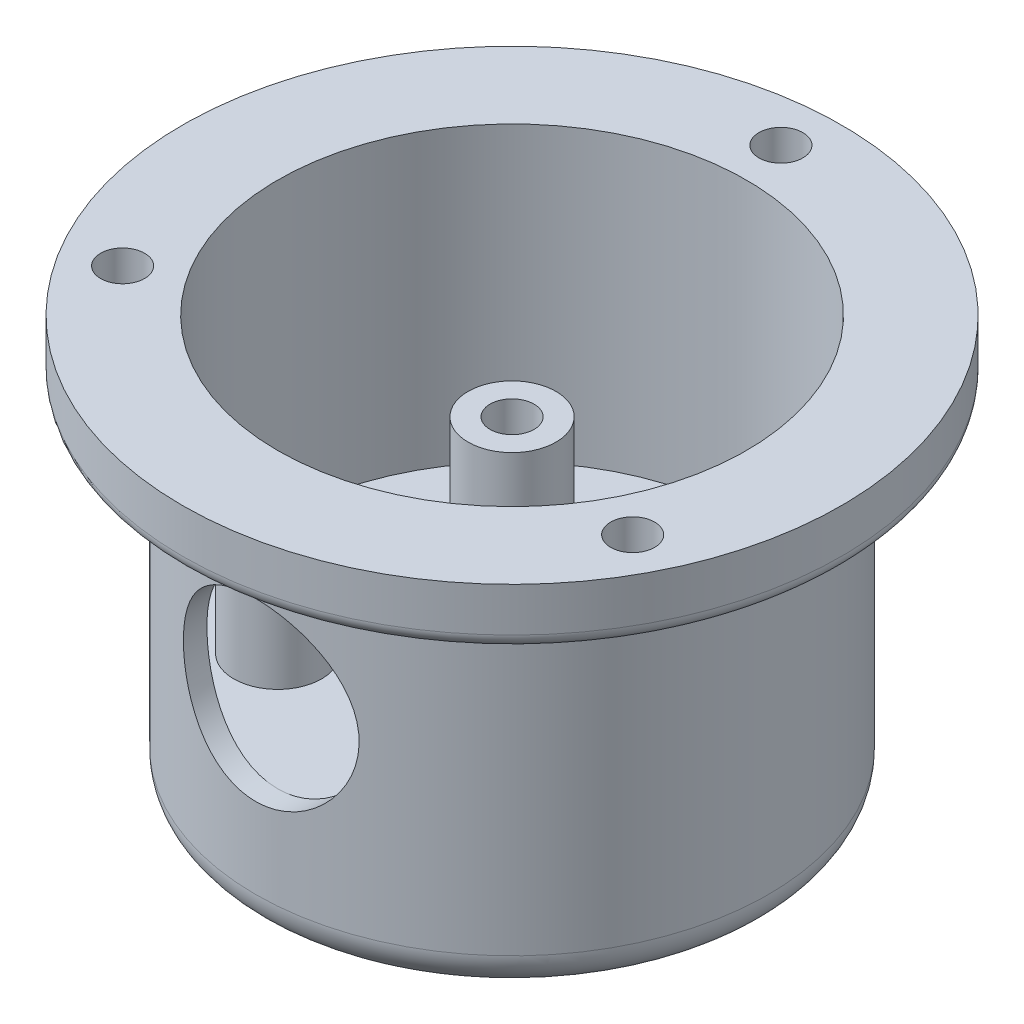
from build123d import *

# Parameters (mm, degrees)
SKETCH1_R               = 22.5
BOSS_EXTRUDE1_DEPTH     = 4
SKETCH2_R               = 17.5
BOSS_EXTRUDE2_DEPTH     = 24
SKETCH3_R               = 16
CUT_EXTRUDE1_DEPTH      = 20
SKETCH4_R               = 3
BOSS_EXTRUDE3_DEPTH     = 6
SKETCH6_R               = 1.5
CUT_EXTRUDE3_DEPTH      = 8
SKETCH7_R               = 1.5
CUT_EXTRUDE4_DEPTH      = 10
CUT_EXTRUDE5_REACH      = 53.79
CUT_EXTRUDE5_END_RADIUS = 16
SKETCH10_R              = 6
FILLET1_R               = 2.5
FILLET2_R               = 1


with BuildPart() as part:
    # Sketch1 → Boss-Extrude1 (new body)
    with BuildSketch(Plane(origin=(0, 0, 0), x_dir=(1, 0, 0), z_dir=(0, 1, 0))):
        with Locations(Location((0, 0, 0), (0, 0, 270))):
            Circle(SKETCH1_R)
    extrude(amount=BOSS_EXTRUDE1_DEPTH)

    # Sketch2 → Boss-Extrude2 (add)
    with BuildSketch(Plane(origin=(0, 0, 0), x_dir=(1, 0, 0), z_dir=(0, 1, 0))):
        with Locations(Location((0, 0, 0), (0, 0, 270))):
            Circle(SKETCH2_R)
    extrude(amount=-BOSS_EXTRUDE2_DEPTH)

    # Sketch3 → Cut-Extrude1 (cut)
    with BuildSketch(Plane(origin=(0, 4, 0), x_dir=(1, 0, 0), z_dir=(0, 1, 0))):
        with Locations(Location((0, 0, 0), (0, 0, 270))):
            Circle(SKETCH3_R)
    extrude(amount=-CUT_EXTRUDE1_DEPTH, mode=Mode.SUBTRACT)

    # Sketch4 → Boss-Extrude3 (add)
    with BuildSketch(Plane(origin=(0, -16, 0), x_dir=(1, 0, 0), z_dir=(0, 1, 0))):
        with Locations(Location((-8, 8, 0), (0, 0, 270))):
            Circle(SKETCH4_R)
        with Locations(Location((8, 8, 0), (0, 0, 270))):
            Circle(SKETCH4_R)
        with Locations(Location((-8, -8, 0), (0, 0, 270))):
            Circle(SKETCH4_R)
        with Locations(Location((8, -8, 0), (0, 0, 270))):
            Circle(SKETCH4_R)
    extrude(amount=BOSS_EXTRUDE3_DEPTH)

    # Sketch6 → Cut-Extrude3 (cut)
    with BuildSketch(Plane(origin=(0, -10, 0), x_dir=(1, 0, 0), z_dir=(0, 1, 0))):
        with Locations(Location((-8, 8, 0), (0, 0, 270))):
            Circle(SKETCH6_R)
        with Locations(Location((8, 8, 0), (0, 0, 270))):
            Circle(SKETCH6_R)
        with Locations(Location((8, -8, 0), (0, 0, 270))):
            Circle(SKETCH6_R)
        with Locations(Location((-8, -8, 0), (0, 0, 270))):
            Circle(SKETCH6_R)
    extrude(amount=-CUT_EXTRUDE3_DEPTH, mode=Mode.SUBTRACT)

    # Sketch7 → Cut-Extrude4 (cut)
    with BuildSketch(Plane(origin=(0, 4, 0), x_dir=(1, 0, 0), z_dir=(0, 1, 0))):
        with Locations(Location((-0.875515832, 19.230079876, 0), (0, 0, 270))):
            Circle(SKETCH7_R)
        with Locations(Location((17.091495605, -8.856820986, 0), (0, 0, 270))):
            Circle(SKETCH7_R)
        with Locations(Location((-16.215979773, -10.37325889, 0), (0, 0, 270))):
            Circle(SKETCH7_R)
    extrude(amount=-CUT_EXTRUDE4_DEPTH, mode=Mode.SUBTRACT)

    # Cut-Extrude5: up to this cylinder (the profile starts outside it)
    cut_extrude5_end = Plane(origin=(0, -10, 0), z_dir=(0, 1, 0)) * Cylinder(CUT_EXTRUDE5_END_RADIUS, 140.58, mode=Mode.PRIVATE)
    # Sketch10 → Cut-Extrude5 (cut, up to the surface)
    with BuildSketch(Plane.XY.offset(17.5), mode=Mode.PRIVATE) as cut_extrude5_sk1:
        with Locations(Location((0, -10, 0), (0, 0, 90))):
            Circle(SKETCH10_R)
    cut_extrude5_tool1 = extrude(cut_extrude5_sk1.sketch, amount=-CUT_EXTRUDE5_REACH, mode=Mode.PRIVATE) - cut_extrude5_end
    add(cut_extrude5_tool1.solids().sort_by_distance((0, -10, 17.5))[0], mode=Mode.SUBTRACT)

    # Fillet1
    fillet1_edges = [part.edges().sort_by_distance(p)[0] for p in [
        (0, -24, -17.5),
    ]]
    fillet(fillet1_edges, radius=FILLET1_R)

    # Fillet2
    fillet2_edges = [part.edges().sort_by_distance(p)[0] for p in [
        (0, 0, -22.5),
    ]]
    fillet(fillet2_edges, radius=FILLET2_R)


solid = part.part
